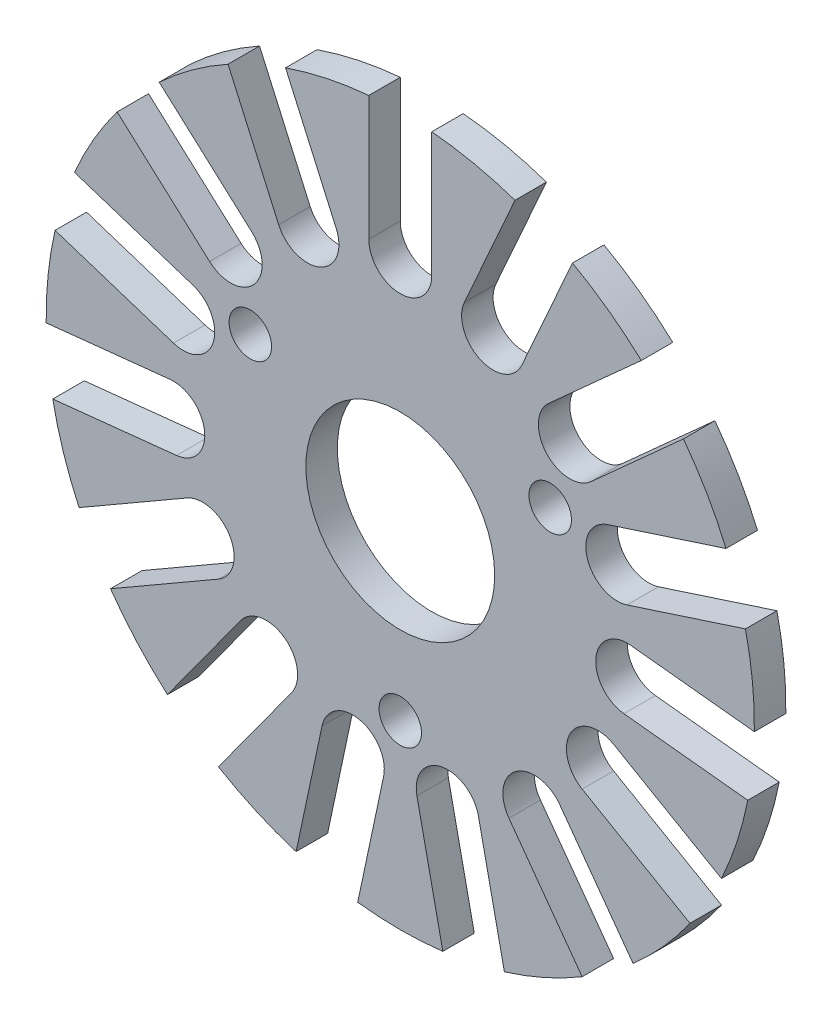
from build123d import *

# Parameters (mm, degrees)
SKETCH1_R           = 1.35
SKETCH1_R_2         = 6
BOSS_EXTRUDE1_DEPTH = 2


with BuildPart() as part:
    # Sketch1 → Boss-Extrude1 (new body)
    with BuildSketch(Plane(origin=(0, 0, 0), x_dir=(-1, 0, 0), z_dir=(0, 0, -1))):
        with BuildLine():
            Line((-15.316309042, 17.102154929), (-9.437338757, 11.808706309))
            ThreePointArc((-9.437338757, 11.808706309), (-9.289310319, 8.984155445), (-12.113861182, 8.836127007))
            Line((-12.113861182, 8.836127007), (-17.992831467, 14.129575627))
            ThreePointArc((-17.992831467, 14.129575627), (-19.485571585, 11.870022867), (-20.696031618, 9.447495623))
            Line((-20.696031618, 9.447495623), (-13.172285497, 7.002882316))
            ThreePointArc((-13.172285497, 7.002882316), (-11.888206454, 4.482735294), (-14.408353475, 3.198656251))
            Line((-14.408353475, 3.198656251), (-21.932099596, 5.643269556))
            ThreePointArc((-21.932099596, 5.643269556), (-22.376742646, 2.971913289), (-22.497222312, 0.266486078))
            Line((-22.497222312, 0.266486078), (-14.62962441, 1.093403939))
            ThreePointArc((-14.62962441, 1.093403939), (-12.431523692, -0.686582926), (-14.211510557, -2.884683643))
            Line((-14.211510557, -2.884683643), (-22.079108459, -3.711601503))
            ThreePointArc((-22.079108459, -3.711601503), (-21.398771617, -6.332859507), (-20.408438887, -8.853393742))
            Line((-20.408438887, -8.853393742), (-13.557368355, -4.897926326))
            ThreePointArc((-13.557368355, -4.897926326), (-10.825317547, -5.629977134), (-11.557368355, -8.362027942))
            Line((-11.557368355, -8.362027942), (-18.408438886, -12.317495358))
            ThreePointArc((-18.408438886, -12.317495358), (-16.720758571, -14.435415779), (-14.790850969, -16.335233771))
            Line((-14.790850969, -16.335233771), (-10.140920148, -9.935153049))
            ThreePointArc((-10.140920148, -9.935153049), (-7.347315654, -9.492689564), (-6.90485217, -12.286294058))
            Line((-6.90485217, -12.286294058), (-11.554782995, -18.686374777))
            ThreePointArc((-11.554782995, -18.686374777), (-9.151574469, -19.934749931), (-6.615790555, -20.885355888))
            Line((-6.615790555, -20.885355888), (-4.971014718, -13.147293963))
            ThreePointArc((-4.971014718, -13.147293963), (-2.598896135, -11.606822144), (-1.058424316, -13.978940727))
            Line((-1.058424316, -13.978940727), (-2.703200152, -21.717002651))
            ThreePointArc((-2.703200152, -21.717002651), (-3e-09, -21.879977134), (2.703200146, -21.717002651))
            Line((2.703200146, -21.717002651), (1.058424314, -13.978940725))
            ThreePointArc((1.058424314, -13.978940725), (2.598896135, -11.606822143), (4.971014718, -13.147293963))
            Line((4.971014718, -13.147293963), (6.615790554, -20.885355888))
            ThreePointArc((6.615790554, -20.885355888), (9.151574469, -19.934749931), (11.554782995, -18.686374777))
            Line((11.554782995, -18.686374777), (6.904852169, -12.286294058))
            ThreePointArc((6.904852169, -12.286294058), (7.347315653, -9.492689564), (10.140920146, -9.935153048))
            Line((10.140920146, -9.935153048), (14.790850972, -16.335233768))
            ThreePointArc((14.790850972, -16.335233768), (16.720758571, -14.435415779), (18.408438883, -12.317495361))
            Line((18.408438883, -12.317495361), (11.557368352, -8.362027946))
            ThreePointArc((11.557368352, -8.362027946), (10.825317543, -5.629977135), (13.557368354, -4.897926327))
            Line((13.557368354, -4.897926327), (20.408438886, -8.853393742))
            ThreePointArc((20.408438886, -8.853393742), (21.398771616, -6.332859507), (22.079108458, -3.711601502))
            Line((22.079108458, -3.711601502), (14.211510556, -2.884683643))
            ThreePointArc((14.211510556, -2.884683643), (12.431523691, -0.686582926), (14.629624409, 1.093403939))
            Line((14.629624409, 1.093403939), (22.497222311, 0.266486078))
            ThreePointArc((22.497222311, 0.266486078), (22.376742645, 2.971913287), (21.932099596, 5.643269552))
            Line((21.932099596, 5.643269552), (14.408353473, 3.19865625))
            ThreePointArc((14.408353473, 3.19865625), (11.888206452, 4.482735295), (13.172285497, 7.002882316))
            Line((13.172285497, 7.002882316), (20.696031618, 9.447495621))
            ThreePointArc((20.696031618, 9.447495621), (19.485571584, 11.870022866), (17.992831465, 14.129575628))
            Line((17.992831465, 14.129575628), (12.113861182, 8.836127007))
            ThreePointArc((12.113861182, 8.836127007), (9.289310318, 8.984155445), (9.437338756, 11.808706308))
            Line((9.437338756, 11.808706308), (15.316309041, 17.102154929))
            ThreePointArc((15.316309041, 17.102154929), (13.225168178, 18.822905238), (10.94243932, 20.279957294))
            Line((10.94243932, 20.279957294), (7.724772239, 13.052958714))
            ThreePointArc((7.724772239, 13.052958714), (5.084208037, 12.039341086), (4.070590408, 14.679905287))
            Line((4.070590408, 14.679905287), (7.288257486, 21.906903868))
            ThreePointArc((7.288257486, 21.906903868), (4.67801304, 22.628343883), (1.999999993, 23.030957697))
            Line((1.999999993, 23.030957697), (1.999999993, 15.120022866))
            ThreePointArc((1.999999993, 15.120022866), (-1e-09, 13.120022872), (-1.999999995, 15.120022866))
            Line((-1.999999995, 15.120022866), (-1.999999995, 23.030957697))
            ThreePointArc((-1.999999995, 23.030957697), (-4.67801304, 22.628343883), (-7.288257483, 21.906903869))
            Line((-7.288257483, 21.906903869), (-4.070590409, 14.679905287))
            ThreePointArc((-4.070590409, 14.679905287), (-5.084208039, 12.039341085), (-7.72477224, 13.052958715))
            Line((-7.72477224, 13.052958715), (-10.942439317, 20.279957296))
            ThreePointArc((-10.942439317, 20.279957296), (-13.225168177, 18.822905239), (-15.316309042, 17.102154929))
        make_face()
        with Locations(Location((9.526279442, 6.120022866, 0), (0, 0, 180))):
            Circle(SKETCH1_R, mode=Mode.SUBTRACT)
        with Locations(Location((-9.526279442, 6.120022866, 0), (0, 0, 180))):
            Circle(SKETCH1_R, mode=Mode.SUBTRACT)
        with Locations(Location((0, -10.379977134, 0), (0, 0, 180))):
            Circle(SKETCH1_R, mode=Mode.SUBTRACT)
        with Locations(Location((0, 0.620022866, 0), (0, 0, 180))):
            Circle(SKETCH1_R_2, mode=Mode.SUBTRACT)
    extrude(amount=-BOSS_EXTRUDE1_DEPTH)


solid = part.part
